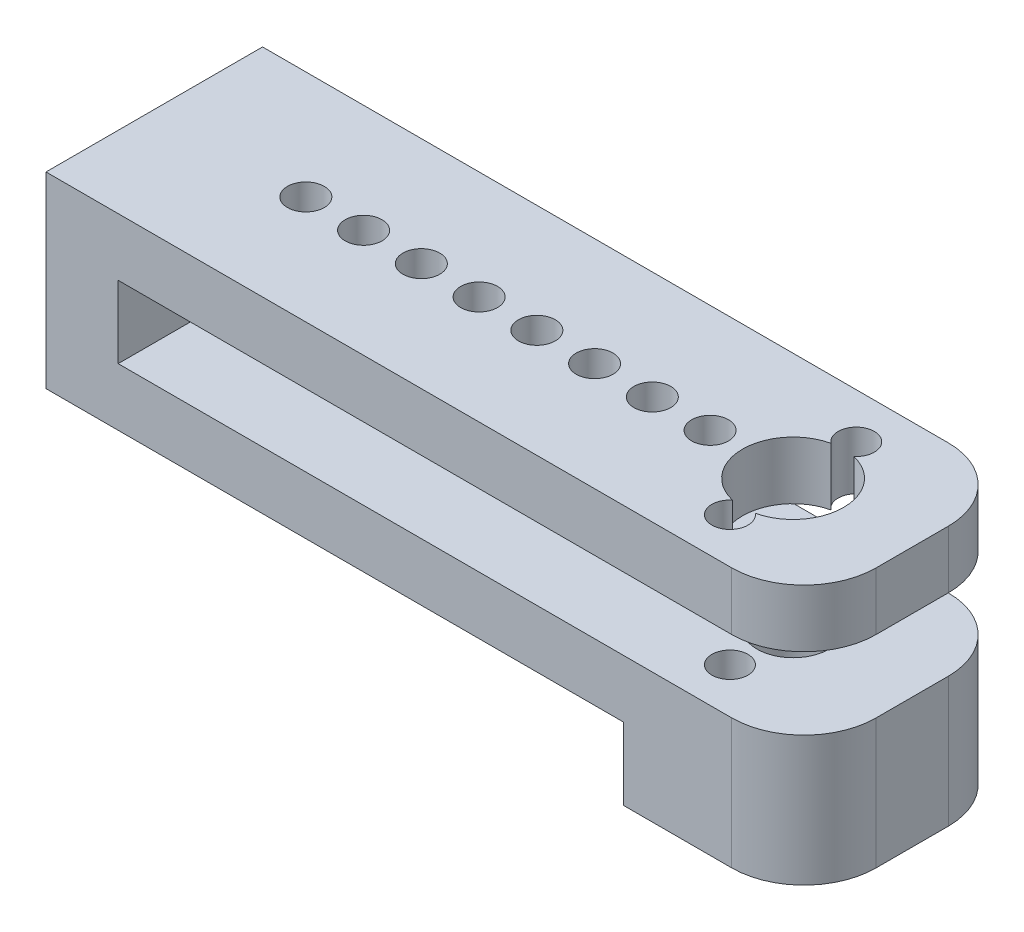
from build123d import *

# Parameters (mm, degrees)
SKETCH2_W                = 75
SKETCH2_H                = 30
BOSS_EXTRUDE1_DEPTH      = 8
SKETCH3_R                = 2.55
CUT_EXTRUDE1_DEPTH       = 7
SKETCH4_R                = 0.6
CUT_EXTRUDE2_DEPTH       = 1
LPATTERN3_COUNT          = 8
LPATTERN3_PITCH          = 8
BOSS_EXTRUDE2_DEPTH      = 5
BOSS_EXTRUDE2_DEPTH_BACK = 5
SKETCH5_W                = 30
SKETCH5_H                = 26
SKETCH6_W                = 30
SKETCH6_H                = 8
BOSS_EXTRUDE3_DEPTH      = 25
SKETCH8_W                = 25
SKETCH8_H                = 30
BOSS_EXTRUDE4_DEPTH      = 5
SKETCH9_W                = 30
SKETCH9_H                = 30
BOSS_EXTRUDE5_DEPTH      = 5
SKETCH11_R               = 11.1
CUT_EXTRUDE3_DEPTH       = 4
SKETCH13_R               = 1.5
CUT_EXTRUDE4_DEPTH       = 85.72307832
SKETCH16_W               = 30
SKETCH16_H               = 8
BOSS_EXTRUDE6_DEPTH      = 25
CUT_EXTRUDE5_DEPTH       = 81.486023631
CUT_EXTRUDE5_DEPTH_BACK  = 13
SKETCH14_R               = 2.5
SKETCH15_R               = 5
CUT_EXTRUDE6_DEPTH       = 85.72307832
FILLET2_R                = 10
FILLET3_R                = 10
CUT_EXTRUDE7_REACH       = 88.313
SKETCH18_R               = 7
SKETCH19_R               = 1.5
CUT_EXTRUDE8_DEPTH       = 101.169855745
SKETCH21_R               = 3.5
CUT_EXTRUDE9_DEPTH       = 3
SKETCH22_W               = 5
SKETCH22_H               = 30
CUT_EXTRUDE10_DEPTH      = 83.643814046


with BuildPart() as part:
    # Sketch2 → Boss-Extrude1 (new body)
    with BuildSketch(Plane(origin=(0, 0, 0), x_dir=(1, 0, 0), z_dir=(0, 1, 0))):
        with Locations((-34.5, 0)):
            Rectangle(SKETCH2_W, SKETCH2_H)
    extrude(amount=BOSS_EXTRUDE1_DEPTH)

    # Sketch3 → Cut-Extrude1 (cut)
    with BuildSketch(Plane(origin=(0, 8, 0), x_dir=(1, 0, 0), z_dir=(0, 1, 0))):
        with Locations(Location((0, 0, 0), (0, 0, 270))):
            Circle(SKETCH3_R)
    cut_extrude1 = extrude(amount=-CUT_EXTRUDE1_DEPTH, mode=Mode.SUBTRACT)

    # Sketch4 → Cut-Extrude2 (cut)
    with BuildSketch(Plane(origin=(0, 1, 0), x_dir=(1, 0, 0), z_dir=(0, 1, 0))):
        with Locations(Location((0, 0, 0), (0, 0, 270))):
            Circle(SKETCH4_R)
    cut_extrude2 = extrude(amount=-CUT_EXTRUDE2_DEPTH, mode=Mode.SUBTRACT)

    # LPattern3: Cut-Extrude1, Cut-Extrude2 ×8
    with Locations(*[(-i * LPATTERN3_PITCH, 0, 0) for i in range(1, LPATTERN3_COUNT)]):
        add(cut_extrude1, mode=Mode.SUBTRACT)
        add(cut_extrude2, mode=Mode.SUBTRACT)


with BuildPart() as body_2:
    # Mirror2: mirrored copy
    add(part.part.mirror(Plane(origin=(0, -5, 0), x_dir=(0, 0, 1), z_dir=(0, -1, 0))))


with BuildPart() as part_1:
    add(part.part)

    add(body_2.part)  # Boss-Extrude2 merges body 2
    # Sketch5 → Boss-Extrude2 (add, two sides: drawn at the far end of the back side and taken through both)
    with BuildSketch(Plane.ZY.offset(72).offset(-BOSS_EXTRUDE2_DEPTH_BACK)):
        with Locations((0, -5)):
            Rectangle(SKETCH5_W, SKETCH5_H)
    extrude(amount=BOSS_EXTRUDE2_DEPTH + BOSS_EXTRUDE2_DEPTH_BACK)

    # Sketch6 → Boss-Extrude3 (add)
    with BuildSketch(Plane(origin=(3, 0, 0), x_dir=(0, 0, -1), z_dir=(1, 0, 0))):
        with Locations((0, -14)):
            Rectangle(SKETCH6_W, SKETCH6_H)
    extrude(amount=BOSS_EXTRUDE3_DEPTH)

    # Sketch8 → Boss-Extrude4 (add)
    with BuildSketch(Plane.XZ.offset(18)):
        with Locations((15.5, 0)):
            Rectangle(SKETCH8_W, SKETCH8_H)
    extrude(amount=BOSS_EXTRUDE4_DEPTH)

    # Sketch9 → Boss-Extrude5 (add)
    with BuildSketch(Plane.XZ.offset(23)):
        with Locations((13, 0)):
            Rectangle(SKETCH9_W, SKETCH9_H)
    extrude(amount=BOSS_EXTRUDE5_DEPTH)

    # Sketch11 → Cut-Extrude3 (cut)
    with BuildSketch(Plane.XZ.offset(28)):
        with Locations(Location((11.5, 0, 0), (0, 0, 270))):
            Circle(SKETCH11_R)
    extrude(amount=-CUT_EXTRUDE3_DEPTH, mode=Mode.SUBTRACT)

    # Sketch13 → Cut-Extrude4 (cut, through all)
    with BuildSketch(Plane.XZ.offset(24)):
        with Locations(Location((11.5, 8.75, 0), (0, 0, 270))):
            Circle(SKETCH13_R)
        with Locations(Location((11.5, -8.75, 0), (0, 0, 270))):
            Circle(SKETCH13_R)
    extrude(amount=-CUT_EXTRUDE4_DEPTH, mode=Mode.SUBTRACT)

    # Sketch16 → Boss-Extrude6 (add)
    with BuildSketch(Plane(origin=(3, 0, 0), x_dir=(0, 0, -1), z_dir=(1, 0, 0))):
        with Locations((0, 4)):
            Rectangle(SKETCH16_W, SKETCH16_H)
    extrude(amount=BOSS_EXTRUDE6_DEPTH)

    # Sketch14 → Cut-Extrude5 (cut, two sides: drawn at the far end of the back side and taken through both)
    with BuildSketch(Plane(origin=(0, -10, 0), x_dir=(1, 0, 0), z_dir=(0, 1, 0)).offset(-CUT_EXTRUDE5_DEPTH_BACK)):
        with Locations(Location((11.5, 8.75, 0), (0, 0, 90))):
            Circle(SKETCH14_R)
        with Locations(Location((11.5, -8.75, 0), (0, 0, 90))):
            Circle(SKETCH14_R)
    extrude(amount=CUT_EXTRUDE5_DEPTH + CUT_EXTRUDE5_DEPTH_BACK, mode=Mode.SUBTRACT)

    # Sketch15 → Cut-Extrude6 (cut, through all)
    with BuildSketch(Plane.XZ.offset(24)):
        with Locations(Location((11.5, 0, 0), (0, 0, 270))):
            Circle(SKETCH15_R)
    extrude(amount=-CUT_EXTRUDE6_DEPTH, mode=Mode.SUBTRACT)

    # Fillet2
    fillet2_edges = [part_1.edges().sort_by_distance(p)[0] for p in [
        (28, -19, 15),
        (28, -19, -15),
    ]]
    fillet(fillet2_edges, radius=FILLET2_R)

    # Fillet3
    fillet3_edges = [part_1.edges().sort_by_distance(p)[0] for p in [
        (28, 4, 15),
        (28, 4, -15),
    ]]
    fillet(fillet3_edges, radius=FILLET3_R)

    # Sketch18 → Cut-Extrude7 (cut, up to next)
    with BuildSketch(Plane(origin=(0, 8, 0), x_dir=(1, 0, 0), z_dir=(0, 1, 0)), mode=Mode.PRIVATE) as cut_extrude7_sk1:
        with Locations((11.5, 0)):
            Circle(SKETCH18_R)
    cut_extrude7_tool1 = extrude(cut_extrude7_sk1.sketch, amount=-CUT_EXTRUDE7_REACH, mode=Mode.PRIVATE) & part_1.part
    add(cut_extrude7_tool1.solids().sort_by_distance((11.5, 8, 0))[0], mode=Mode.SUBTRACT)

    # Sketch19 → Cut-Extrude8 (cut, through all)
    with BuildSketch(Plane(origin=(-67, 0, 0), x_dir=(0, 0, -1), z_dir=(1, 0, 0))):
        with Locations((0, -5)):
            Circle(SKETCH19_R)
    extrude(amount=-CUT_EXTRUDE8_DEPTH, mode=Mode.SUBTRACT)

    # Sketch21 → Cut-Extrude9 (cut)
    with BuildSketch(Plane(origin=(-67, 0, 0), x_dir=(0, 0, -1), z_dir=(1, 0, 0))):
        with Locations((0, -5)):
            Circle(SKETCH21_R)
    extrude(amount=-CUT_EXTRUDE9_DEPTH, mode=Mode.SUBTRACT)

    # Sketch22 → Cut-Extrude10 (cut, through all)
    with BuildSketch(Plane.XZ.offset(18)):
        with Locations((0.5, 0)):
            Rectangle(SKETCH22_W, SKETCH22_H)
    extrude(amount=CUT_EXTRUDE10_DEPTH, mode=Mode.SUBTRACT)


solid = part_1.part
